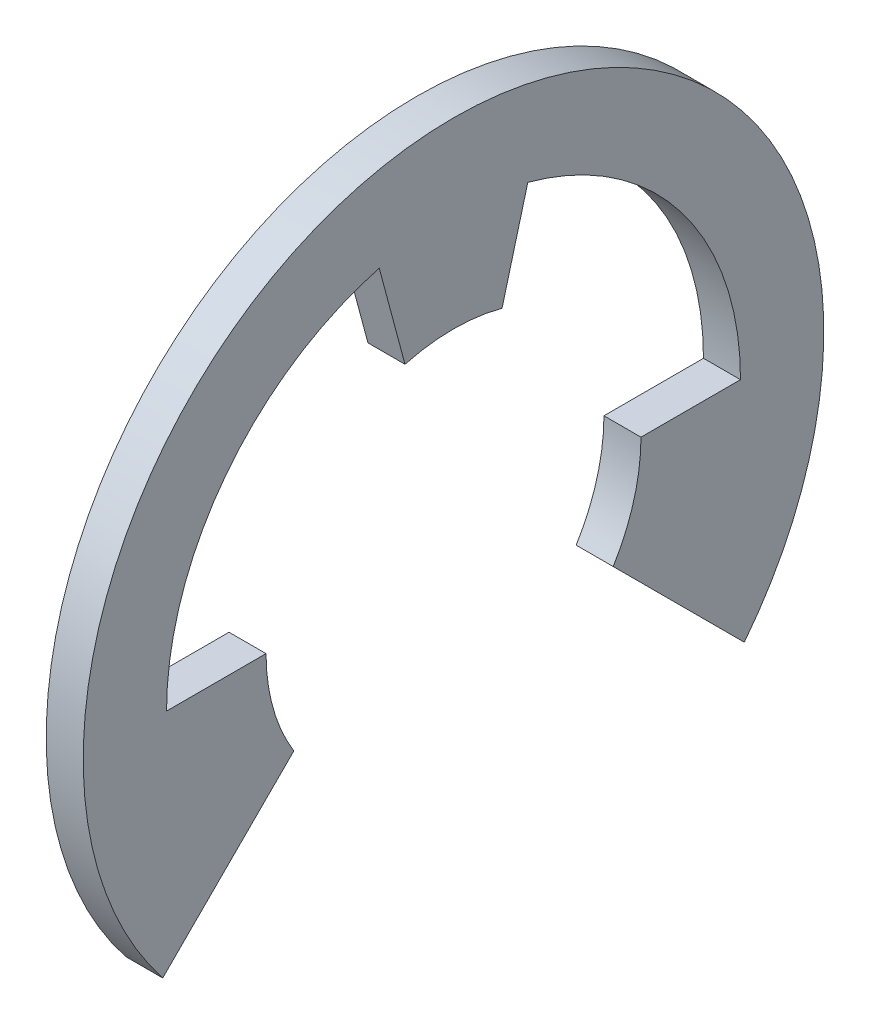
from build123d import *

# Parameters (mm, degrees)
BOSS_EXTRUDE1_DEPTH = 0.8


with BuildPart() as part:
    # Sketch1 → Boss-Extrude1 (new body)
    with BuildSketch(Plane(origin=(0, 0, 0), x_dir=(0, 0, -1), z_dir=(1, 0, 0))):
        with BuildLine():
            Line((-4.05, 0), (-6.2, 0))
            ThreePointArc((-6.2, 0), (-4.91879071, 3.77432086), (-1.60467808, 5.988740123))
            Line((-1.60467808, 5.988740123), (-1.048217133, 3.911999596))
            ThreePointArc((-1.048217133, 3.911999596), (0, 4.05), (1.048217133, 3.911999596))
            Line((1.048217133, 3.911999596), (1.60467808, 5.988740123))
            ThreePointArc((1.60467808, 5.988740123), (4.91879071, 3.77432086), (6.2, 0))
            Line((6.2, 0), (4.05, 0))
            ThreePointArc((4.05, 0), (3.897114317, -1.102270384), (3.45, -2.121320344))
            Line((3.45, -2.121320344), (6.282048667, -4.95336901))
            ThreePointArc((6.282048667, -4.95336901), (0, 8), (-6.282048667, -4.95336901))
            Line((-6.282048667, -4.95336901), (-3.45, -2.121320344))
            ThreePointArc((-3.45, -2.121320344), (-3.897114317, -1.102270384), (-4.05, 0))
        make_face()
    extrude(amount=BOSS_EXTRUDE1_DEPTH)


solid = part.part
